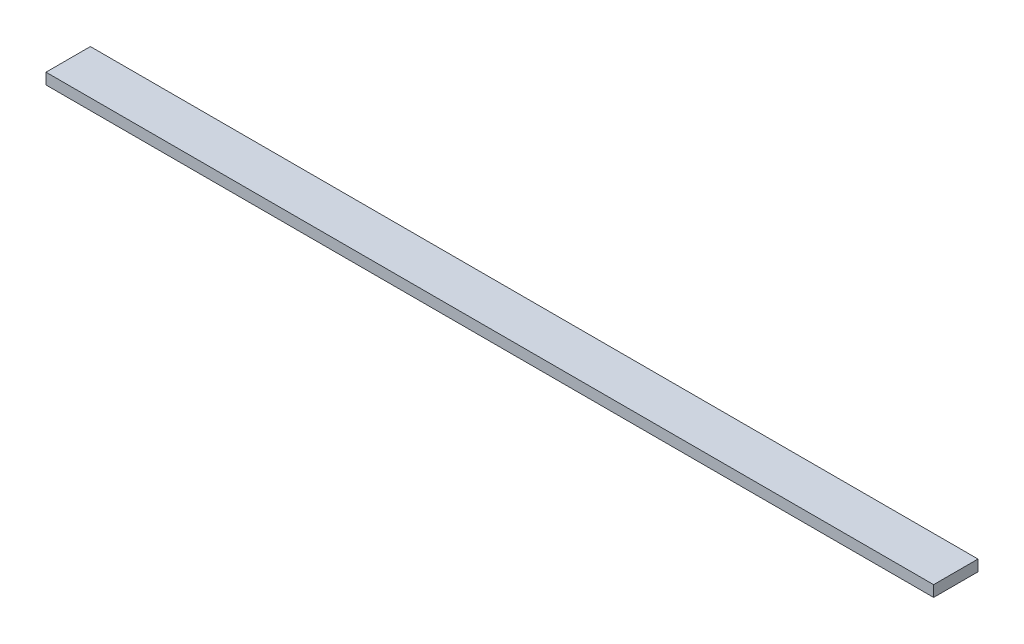
from build123d import *

# Parameters (mm, degrees)
SKETCH1_W           = 508
SKETCH1_H           = 25.4
BOSS_EXTRUDE1_DEPTH = 6.35


with BuildPart() as part:
    # Sketch1 → Boss-Extrude1 (new body)
    with BuildSketch(Plane(origin=(0, 0, 0), x_dir=(1, 0, 0), z_dir=(0, 1, 0))):
        Rectangle(SKETCH1_W, SKETCH1_H)
    extrude(amount=BOSS_EXTRUDE1_DEPTH)


solid = part.part
